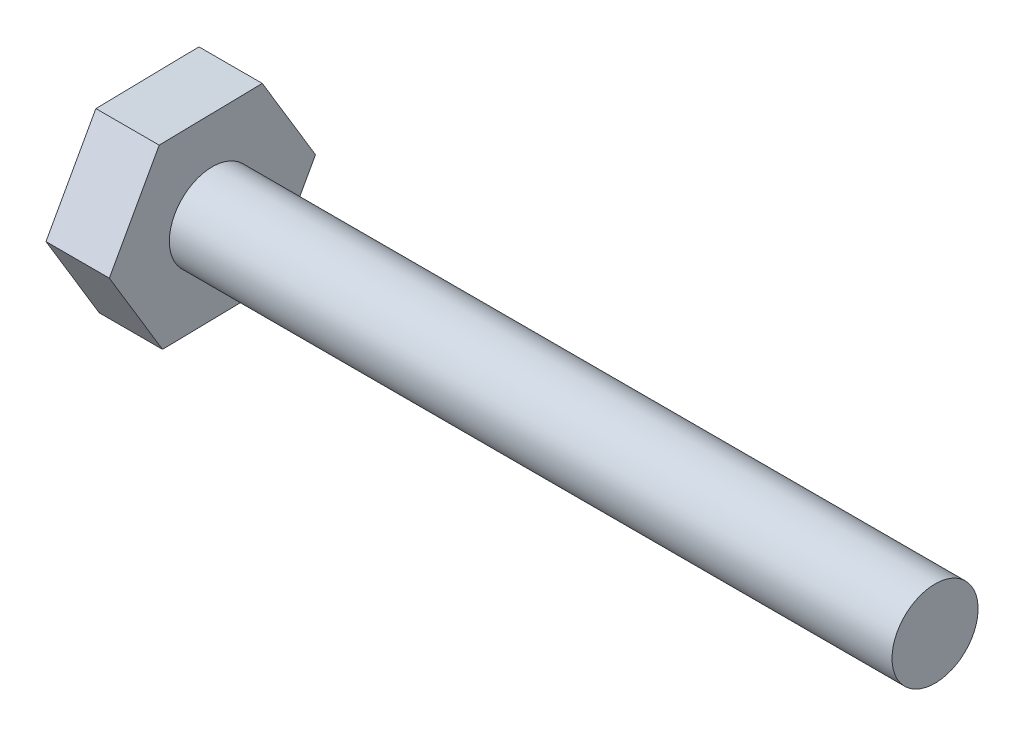
from build123d import *

# Parameters (mm, degrees)
BOSS_EXTRUDE1_DEPTH = 4.913831128
SKETCH1_3_R         = 3.34
BOSS_EXTRUDE2_DEPTH = 61


with BuildPart() as part:
    # Sketch1 → Boss-Extrude1 (new body)
    with BuildSketch(Plane(origin=(0, 0, 0), x_dir=(0, 0, -1), z_dir=(1, 0, 0))):
        Polygon((-3.870438982, -7.003777701), (4.130229921, -6.853787333), (8.000668903, 0.149990369), (3.870438982, 7.003777701), (-4.130229921, 6.853787333), (-8.000668903, -0.149990369), align=None)
    extrude(amount=BOSS_EXTRUDE1_DEPTH)

    # Sketch1<3> → Boss-Extrude2 (add)
    with BuildSketch(Plane(origin=(0, 0, 0), x_dir=(0, 0, -1), z_dir=(1, 0, 0))):
        Circle(SKETCH1_3_R)
    extrude(amount=BOSS_EXTRUDE2_DEPTH)


solid = part.part
